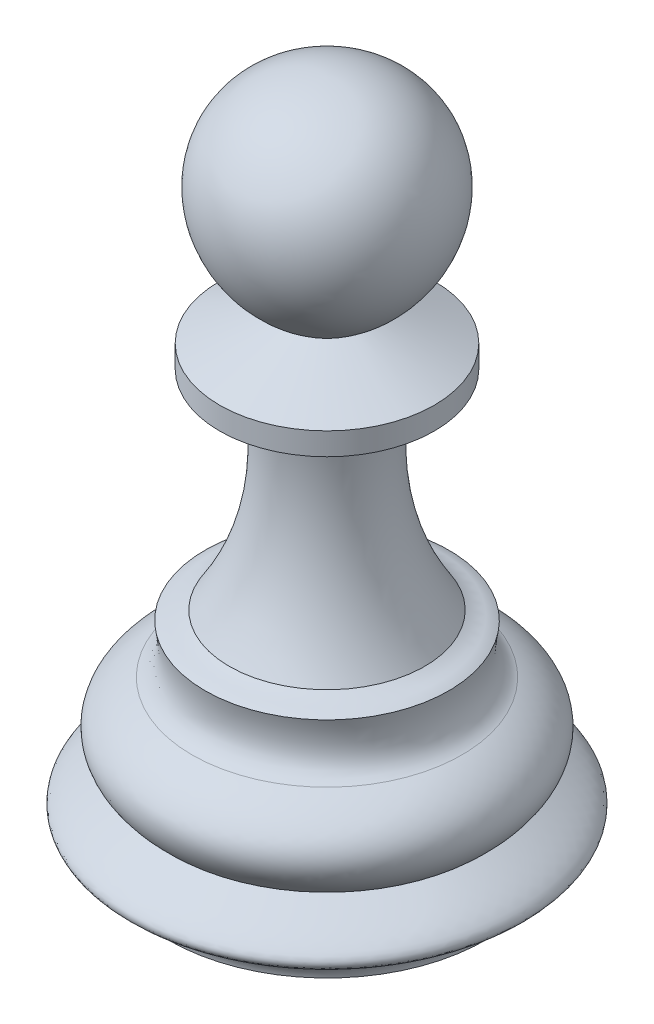
from build123d import *

# Parameters (mm, degrees)
SCALE1_SCALE = 0.5


with BuildPart() as part:
    # Sketch1 → Revolve1 (revolve)
    with BuildSketch(Plane.XY, mode=Mode.PRIVATE) as revolve1_sk:
        with BuildLine():
            Line((0, 0), (120.042284428, 0))
            add(Edge.make_bspline(
                [(120.042284428, 0), (121.158272138, 9.5144298), (128.305641039, 14.27963326), (136.620290477, 19.308568774)],
                knots=[0, 0, 0, 0, 1, 1, 1, 1], degree=3))
            add(Edge.make_bspline(
                [(136.620290477, 19.308568774), (160.602241172, 28.848950954), (150.985141909, 35.504314935), (116.798761506, 53.906146614)],
                knots=[0, 0, 0, 0, 1, 1, 1, 1], degree=3))
            add(Edge.make_bspline(
                [(116.798761506, 53.906146614), (142.272746661, 76.557306673), (133.519617574, 98.187419869), (102.049109373, 112.34914856)],
                knots=[0, 0, 0, 0, 1, 1, 1, 1], degree=3))
            add(Edge.make_bspline(
                [(102.049109373, 112.34914856), (85.674700219, 120.139362549), (92.225673755, 149.510117393)],
                knots=[0, 0, 0, 1, 1, 1], degree=2))
            add(Edge.make_bspline(
                [(92.225673755, 149.510117393), (85.294439582, 153.054174719), (82.666025189, 151.878670704), (73.972273771, 156.379866313)],
                knots=[0, 0, 0, 0, 1, 1, 1, 1], degree=3))
            add(Edge.make_bspline(
                [(73.972273771, 156.379866313), (29.531553321, 225.070955796), (47.231591743, 314.217797403)],
                knots=[0, 0, 0, 1, 1, 1], degree=2))
            Line((47.231591743, 314.217797403), (81.241868572, 314.217797403))
            Line((81.241868572, 314.217797403), (81.241868572, 331.181422321))
            Line((81.241868572, 331.181422321), (27.495730216, 354.359444487))
            add(Edge.make_bspline(
                [(27.495730216, 354.359444487), (107.474597891, 401.369632918), (87.188552487, 504.989489508), (0, 506.627591868)],
                knots=[0, 0, 0, 0, 1, 1, 1, 1], degree=3))
            Line((0, 506.627591868), (0, 0))
        make_face()
    revolve(revolve1_sk.sketch.rotate(Axis((0, 506.627591868, 0), (0, -1, 0)), 90), axis=Axis((0, 506.627591868, 0), (0, -1, 0)))


with BuildPart() as part_1:
    # Scale1: scaled about (0, 0, 0)
    add(part.part.scale(SCALE1_SCALE))


solid = part_1.part
